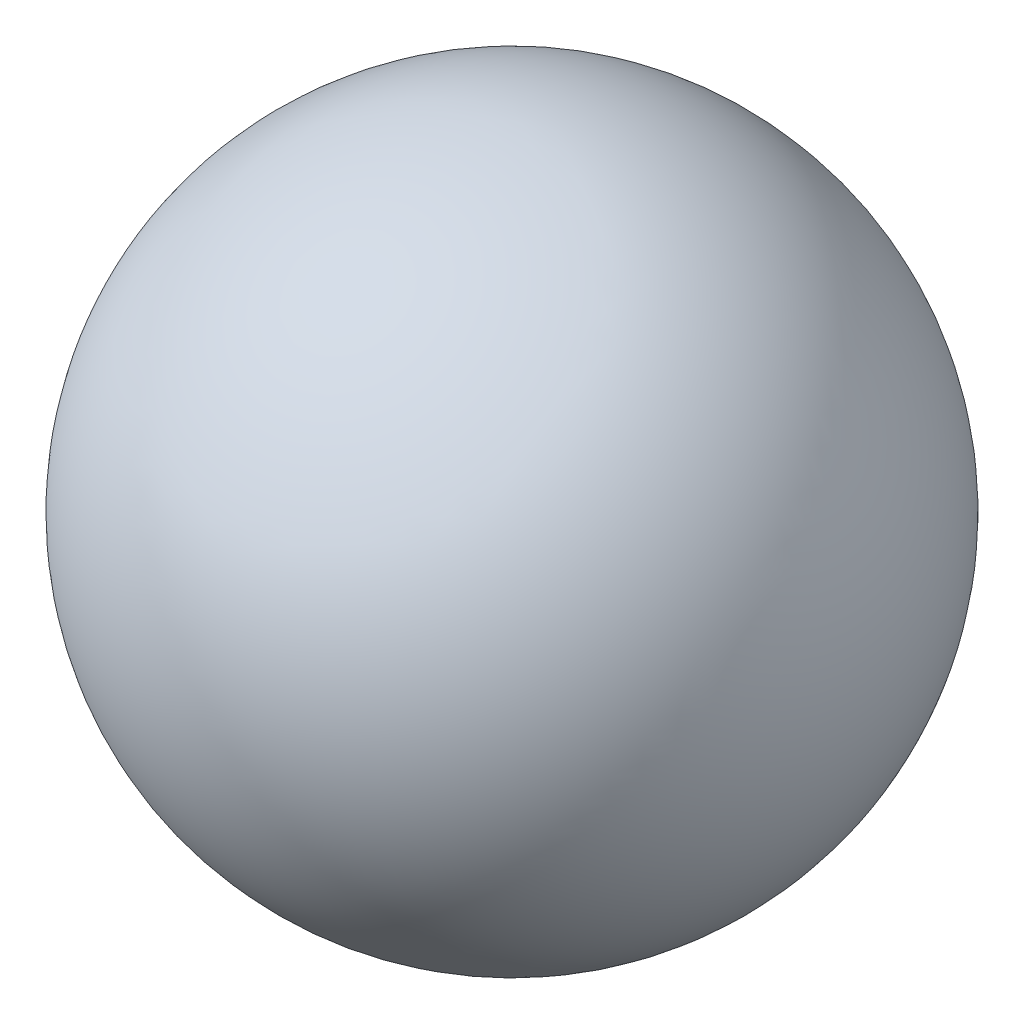
from build123d import *

# Parameters (mm, degrees)
FURO_ROSCADO_DE_M12X1_51_D           = 10.5
FURO_ROSCADO_DE_M12X1_51_DEPTH       = 30
FURO_ROSCADO_DE_M12X1_51_CSINK_D     = 12.05
FURO_ROSCADO_DE_M12X1_51_CSINK_ANGLE = 90
FURO_ROSCADO_DE_M12X1_51_TIP         = 3.15451825


with BuildPart() as part:
    # Esboço1 → Revolução1 (revolve)
    with BuildSketch(Plane(origin=(0, 0, 0), x_dir=(1, 0, 0), z_dir=(0, 1, 0))):
        with BuildLine():
            Line((46.627416998, 0), (0, 0))
            Line((0, 0), (0, 8))
            ThreePointArc((0, 8), (26.685864487, 23.654365432), (46.627416998, 0))
        make_face()
    revolve(axis=Axis((5.928556183, 0, 0), (1, 0, 0)))

    # Furo roscado de M12x1.51
    with Locations(Plane.ZY):
        with Locations((0, 0)):
            CounterSinkHole(FURO_ROSCADO_DE_M12X1_51_D / 2, FURO_ROSCADO_DE_M12X1_51_CSINK_D / 2, depth=FURO_ROSCADO_DE_M12X1_51_DEPTH, counter_sink_angle=FURO_ROSCADO_DE_M12X1_51_CSINK_ANGLE)
            with Locations((0, 0, -(FURO_ROSCADO_DE_M12X1_51_DEPTH + FURO_ROSCADO_DE_M12X1_51_TIP / 2))):  # 118° drill point
                Cone(0, FURO_ROSCADO_DE_M12X1_51_D / 2, FURO_ROSCADO_DE_M12X1_51_TIP, mode=Mode.SUBTRACT)


solid = part.part
